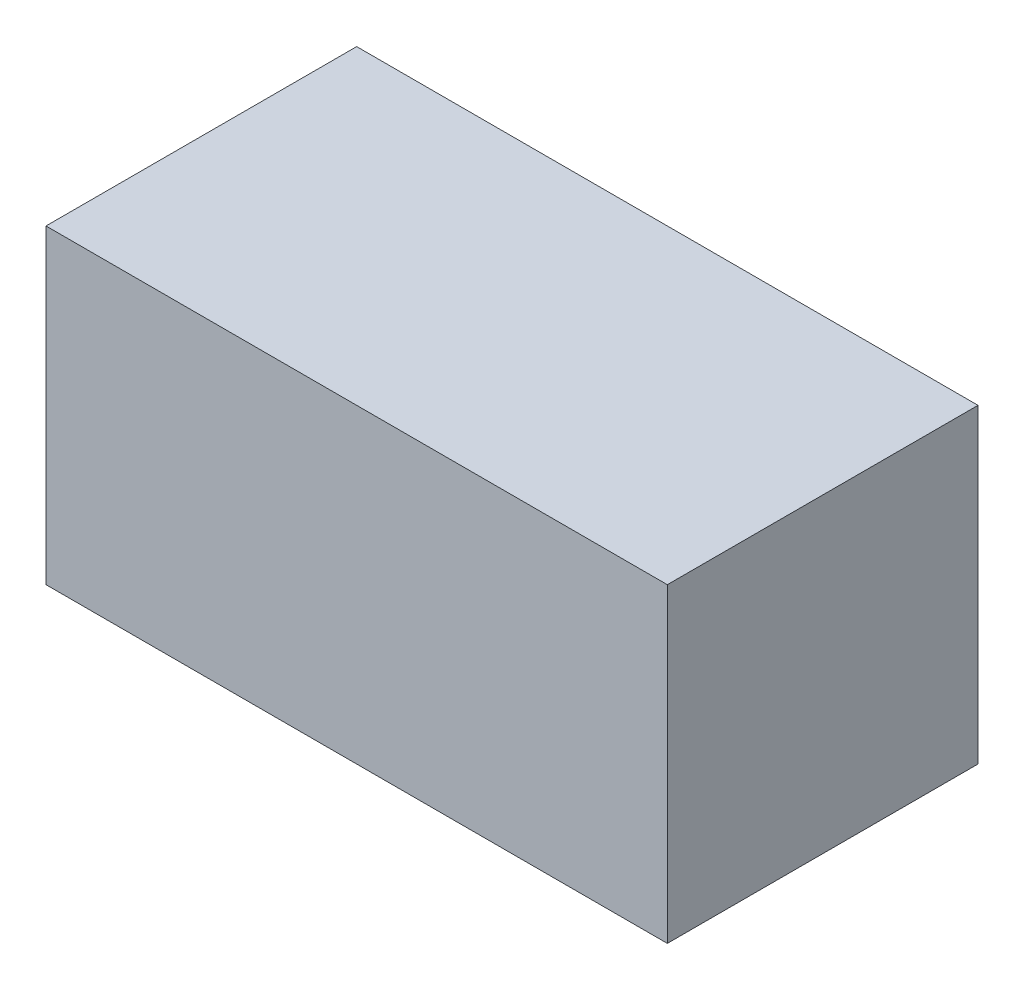
from build123d import *

# Parameters (mm, degrees)
ESQUISSE1_W        = 20
ESQUISSE1_H        = 10
BOSS_EXTRU_1_DEPTH = 10


with BuildPart() as part:
    # Esquisse1 → Boss.-Extru.1 (new body)
    with BuildSketch(Plane.XY):
        Rectangle(ESQUISSE1_W, ESQUISSE1_H)
    extrude(amount=BOSS_EXTRU_1_DEPTH)


solid = part.part
